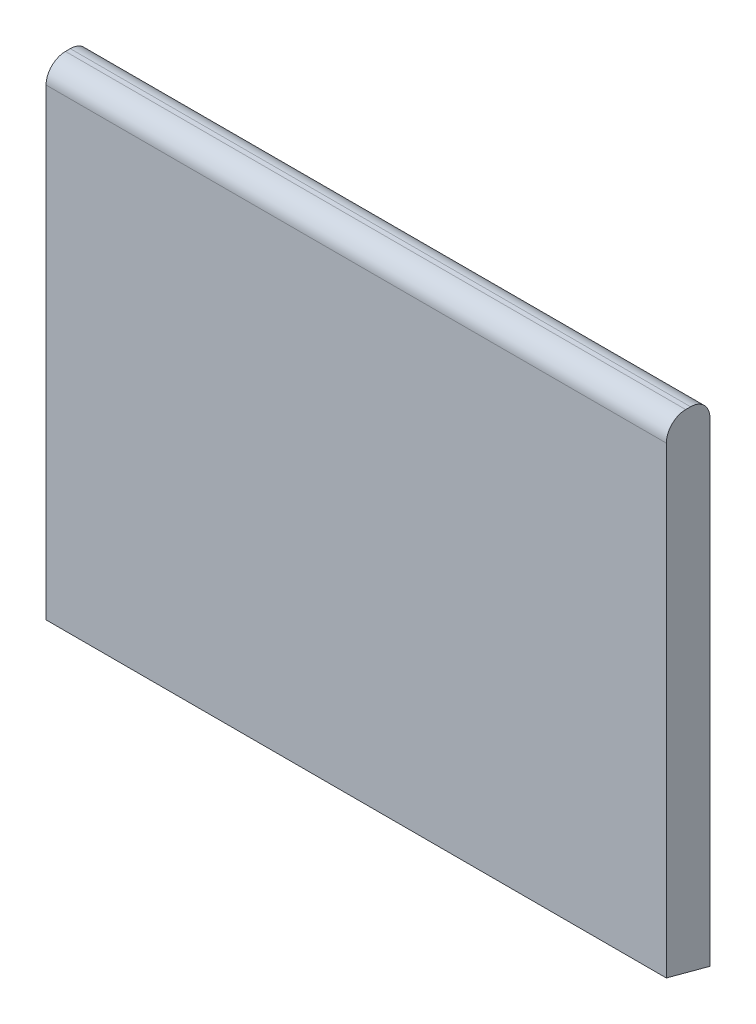
from build123d import *

# Parameters (mm, degrees)
ESQUISSE1_W                  = 256
ESQUISSE1_H                  = 204
BOSS_EXTRU_1_DEPTH           = 18
CONG_1_R                     = 8
ENL_V_MAT_EXTRU_2_DEPTH      = 328.835324515
ENL_V_MAT_EXTRU_2_DEPTH_BACK = 328.835324515


with BuildPart() as part:
    # Esquisse1 → Boss.-Extru.1 (new body)
    with BuildSketch(Plane.XY):
        with Locations((128, 102)):
            Rectangle(ESQUISSE1_W, ESQUISSE1_H)
    extrude(amount=BOSS_EXTRU_1_DEPTH)

    # Congé1
    cong_1_edges = [part.edges().sort_by_distance(p)[0] for p in [
        (128, 204, 18),
        (128, 204, 0),
    ]]
    fillet(cong_1_edges, radius=CONG_1_R)

    # Esquisse4 → Enlèv. mat.-Extru.2 (cut, two sides: drawn at the far end of the back side and taken through both)
    with BuildSketch(Plane(origin=(256, 0, 0), x_dir=(0, 0, -1), z_dir=(1, 0, 0)).offset(-ENL_V_MAT_EXTRU_2_DEPTH_BACK)):
        Polygon((0, 0), (-18, 0), (-18, 4.823085464), align=None)
    extrude(amount=ENL_V_MAT_EXTRU_2_DEPTH + ENL_V_MAT_EXTRU_2_DEPTH_BACK, mode=Mode.SUBTRACT)


solid = part.part
